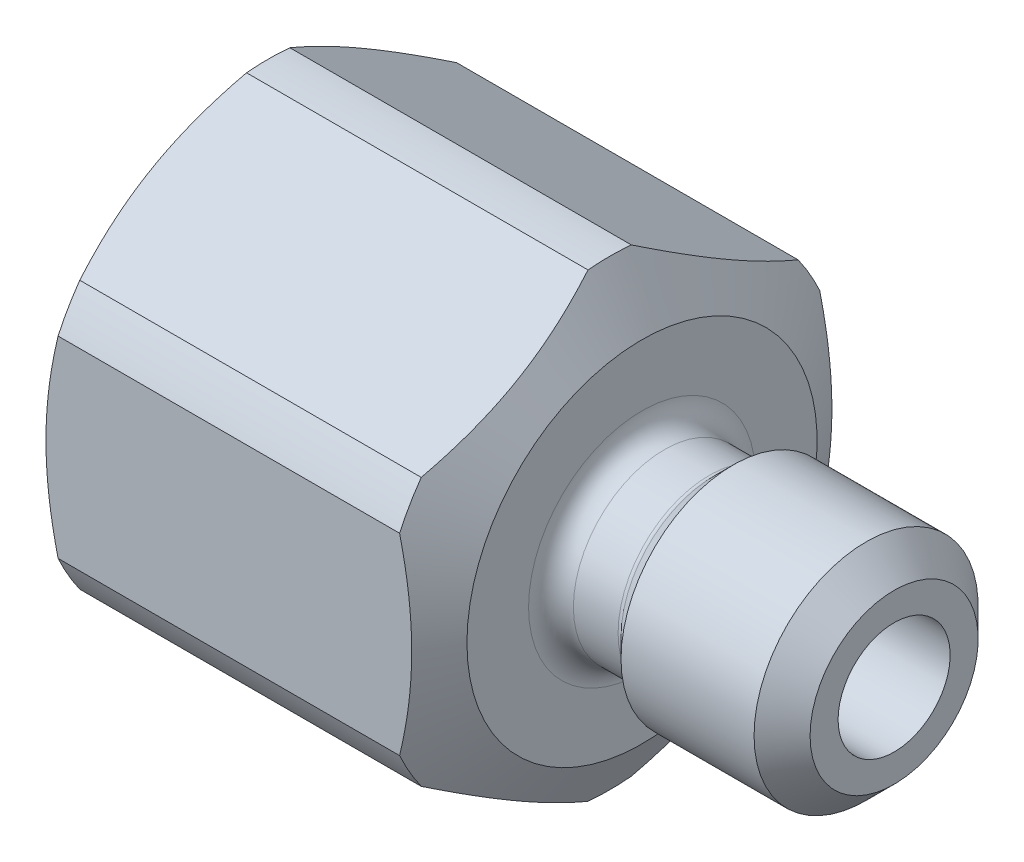
from build123d import *

# Parameters (mm, degrees)
HOLE_WIZARD_1_D           = 17.5
HOLE_WIZARD_1_DEPTH       = 23.999
HOLE_WIZARD_1_CSINK_D     = 22.5
HOLE_WIZARD_1_CSINK_ANGLE = 90
SKETCH_4_OUTSIDE_W        = 48.246
SKETCH_4_OUTSIDE_H        = 48.246
CUT_EXTRUDE_1_DEPTH       = 53.473802988


with BuildPart() as part:
    # Эскиз1 → Повернуть1 (revolve)
    with BuildSketch(Plane.XY, mode=Mode.PRIVATE) as revolve_1_sk:
        with BuildLine():
            Line((30.6, 6.5), (33.792893219, 6.5))
            ThreePointArc((33.792893219, 6.5), (33.984234935, 6.538060234), (34.146446609, 6.646446609))
            Line((34.146446609, 6.646446609), (35.5, 8))
            Line((35.5, 8), (45, 8))
            Line((45, 8), (47, 6))
            Line((47, 6), (47, 4))
            Line((47, 4), (26, 4))
            Line((26, 4), (24, 6))
            Line((24, 6), (24, 8.9))
            ThreePointArc((24, 8.9), (23.53137085, 10.03137085), (22.4, 10.5))
            Line((22.4, 10.5), (19.207106781, 10.5))
            ThreePointArc((19.207106781, 10.5), (19.015765065, 10.461939766), (18.853553391, 10.353553391))
            Line((18.853553391, 10.353553391), (8.5, 0))
            Line((8.5, 0), (0, 0))
            Line((0, 0), (0, 12.5))
            Line((0, 12.5), (2.309401077, 16.5))
            Line((2.309401077, 16.5), (26.690598923, 16.5))
            Line((26.690598923, 16.5), (29, 12.5))
            Line((29, 12.5), (29, 8.1))
            ThreePointArc((29, 8.1), (29.46862915, 6.96862915), (30.6, 6.5))
        make_face()
    revolve(revolve_1_sk.sketch.rotate(Axis((-14.464864865, 0, 0), (1, 0, 0)), 90), axis=Axis((-14.464864865, 0, 0), (1, 0, 0)))

    # Отверстие обработанное метчиком 1
    with Locations(Plane.ZY):
        with Locations((0, 0)):
            CounterSinkHole(HOLE_WIZARD_1_D / 2, HOLE_WIZARD_1_CSINK_D / 2, depth=HOLE_WIZARD_1_DEPTH, counter_sink_angle=HOLE_WIZARD_1_CSINK_ANGLE)

    # Эскиз4 outside → Вырез-Вытянуть1 (cut, through all)
    with BuildSketch(Plane.ZY):
        Rectangle(SKETCH_4_OUTSIDE_W, SKETCH_4_OUTSIDE_H)
        Polygon((0, 17.320508076), (-15, 8.660254038), (-15, -8.660254038), (0, -17.320508076), (15, -8.660254038), (15, 8.660254038), align=None, mode=Mode.SUBTRACT)
    extrude(amount=-CUT_EXTRUDE_1_DEPTH, mode=Mode.SUBTRACT)


solid = part.part
